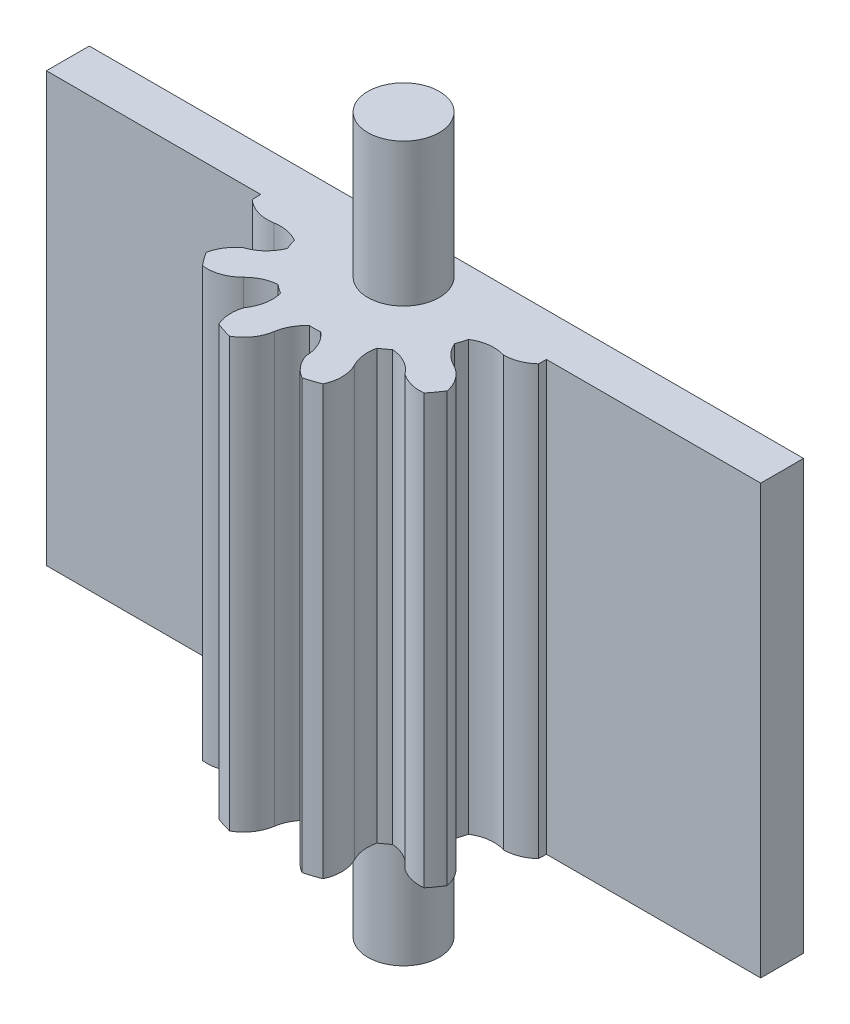
from build123d import *

# Parameters (mm, degrees)
CROQUIS1_W                   = 50
CROQUIS1_H                   = 30
SALIENTE_EXTRUIR1_DEPTH      = 3
SALIENTE_EXTRUIR2_DEPTH      = 15
SALIENTE_EXTRUIR2_DEPTH_BACK = 15
CORTAR_EXTRUIR1_DEPTH        = 60.741108125
CROQUIS4_R                   = 2.5
SALIENTE_EXTRUIR3_DEPTH      = 10


with BuildPart() as part:
    # Croquis1 → Saliente-Extruir1 (new body)
    with BuildSketch(Plane.XY):
        with Locations((25, 15)):
            Rectangle(CROQUIS1_W, CROQUIS1_H)
    extrude(amount=SALIENTE_EXTRUIR1_DEPTH)

    # Croquis2 → Saliente-Extruir2 (add, two sides: drawn at the far end of the back side and taken through both)
    with BuildSketch(Plane(origin=(0, 15, 0), x_dir=(1, 0, 0), z_dir=(0, 1, 0)).offset(-SALIENTE_EXTRUIR2_DEPTH_BACK)):
        with BuildLine():
            Line((15, -3), (35, -3))
            ThreePointArc((35, -3), (25, -13), (15, -3))
        make_face()
    extrude(amount=SALIENTE_EXTRUIR2_DEPTH + SALIENTE_EXTRUIR2_DEPTH_BACK)

    # Croquis3 → Cortar-Extruir1 (cut, through all)
    with BuildSketch(Plane(origin=(0, 30, 0), x_dir=(1, 0, 0), z_dir=(0, 1, 0))):
        with BuildLine():
            ThreePointArc((17.281029865, -9.357475919), (18.433447729, -9.235618719), (19.413280597, -8.616875104))
            ThreePointArc((19.413280597, -8.616875104), (20.164937796, -8.08539476), (21.05409871, -7.846956572))
            ThreePointArc((21.05409871, -7.846956572), (21.364087604, -8.083627253), (21.688234212, -8.300503029))
            ThreePointArc((21.688234212, -8.300503029), (21.719260259, -9.423145978), (21.277056507, -10.455495555))
            ThreePointArc((21.277056507, -10.455495555), (21.160716532, -11.401170735), (21.390501043, -12.325852094))
            ThreePointArc((21.390501043, -12.325852094), (19.144543803, -11.106394558), (17.281029865, -9.357475919))
        make_face()
        with BuildLine():
            ThreePointArc((17.605845109, -6.843331325), (18.570395316, -6.268063818), (19.205167685, -5.34158994))
            ThreePointArc((19.205167685, -5.34158994), (19.070403954, -4.975605156), (18.958729207, -4.601927653))
            ThreePointArc((18.958729207, -4.601927653), (18.099232466, -4.272192527), (17.17873271, -4.260356141))
            ThreePointArc((17.17873271, -4.260356141), (16.022342896, -4.184998931), (15.018391395, -3.606209252))
            ThreePointArc((15.018391395, -3.606209252), (15.498017257, -6.116460163), (16.598255677, -8.423162576))
            ThreePointArc((16.598255677, -8.423162576), (16.955870168, -7.540015696), (17.605845109, -6.843331325))
        make_face()
        with BuildLine():
            ThreePointArc((22.492052569, -12.680402868), (23.35275234, -11.904444098), (23.781765411, -10.827938688))
            ThreePointArc((23.781765411, -10.827938688), (24.07747255, -9.956149042), (24.65666839, -9.240612823))
            ThreePointArc((24.65666839, -9.240612823), (25.046566209, -9.249876526), (25.436282706, -9.234804119))
            ThreePointArc((25.436282706, -9.234804119), (26.121256275, -10.12480469), (26.370305781, -11.219913886))
            ThreePointArc((26.370305781, -11.219913886), (26.832038689, -12.053364099), (27.561452328, -12.666383086))
            ThreePointArc((27.561452328, -12.666383086), (25.027655598, -12.999961758), (22.492052569, -12.680402868))
        make_face()
        with BuildLine():
            ThreePointArc((28.661025949, -12.305744946), (28.90124957, -11.172074481), (28.615574431, -10.048995755))
            ThreePointArc((28.615574431, -10.048995755), (28.342381435, -9.16989082), (28.390379076, -8.250567086))
            ThreePointArc((28.390379076, -8.250567086), (28.711258105, -8.028885391), (29.017686036, -7.787621948))
            ThreePointArc((29.017686036, -7.787621948), (30.094970504, -8.105030174), (30.940144821, -8.844604497))
            ThreePointArc((30.940144821, -8.844604497), (31.803584335, -9.24748009), (32.754015885, -9.314684288))
            ThreePointArc((32.754015885, -9.314684288), (30.900203893, -11.073883453), (28.661025949, -12.305744946))
        make_face()
        with BuildLine():
            ThreePointArc((33.43161185, -8.376608746), (32.959602062, -7.318250172), (32.068356907, -6.57757603))
            ThreePointArc((32.068356907, -6.57757603), (31.330614215, -6.026944012), (30.829080189, -5.254983182))
            ThreePointArc((30.829080189, -5.254983182), (30.958375546, -4.887030963), (31.064469856, -4.511730919))
            ThreePointArc((31.064469856, -4.511730919), (32.122579172, -4.135307644), (33.241050438, -4.236854841))
            ThreePointArc((33.241050438, -4.236854841), (34.17639201, -4.05527103), (34.984808923, -3.55099072))
            ThreePointArc((34.984808923, -3.55099072), (34.519074843, -6.06385609), (33.43161185, -8.376608746))
        make_face()
    extrude(amount=-CORTAR_EXTRUIR1_DEPTH, mode=Mode.SUBTRACT)

    # Croquis4 → Saliente-Extruir3 (add)
    with BuildSketch(Plane(origin=(0, 30, 0), x_dir=(1, 0, 0), z_dir=(0, 1, 0))):
        with Locations(Location((25, -3, 0), (0, 0, 90))):
            Circle(CROQUIS4_R)
    saliente_extruir3 = extrude(amount=SALIENTE_EXTRUIR3_DEPTH)

    # Simetría2: Saliente-Extruir3 across plane
    add(saliente_extruir3.mirror(Plane.ZX.offset(15)))


solid = part.part
